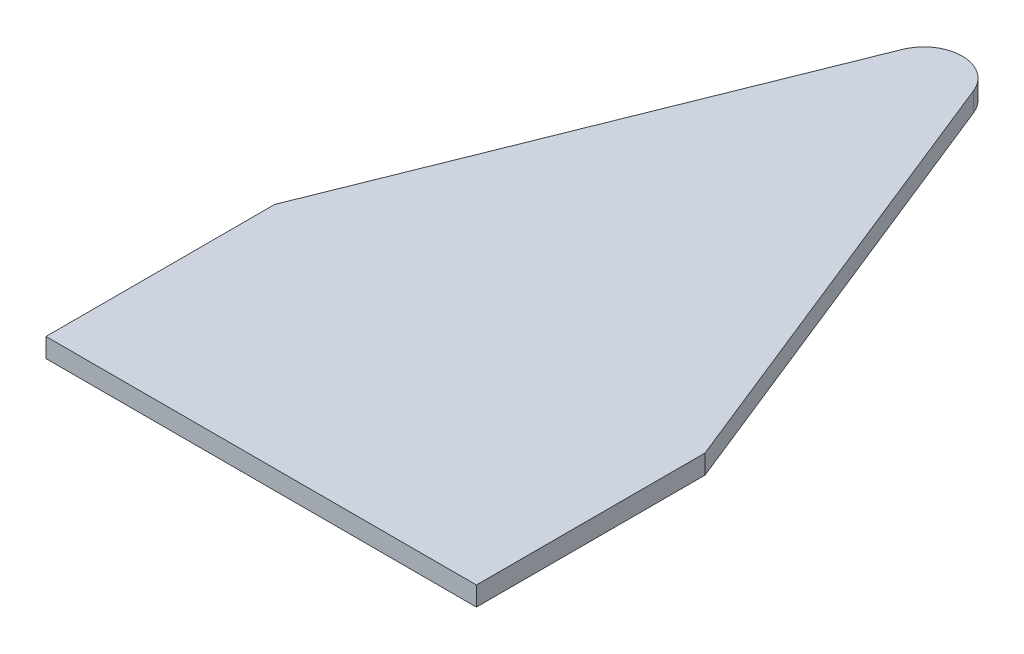
from build123d import *

# Parameters (mm, degrees)
SKETCH1_W           = 142.494
SKETCH1_H           = 75.692
BOSS_EXTRUDE2_DEPTH = 6.35
FILLET4_R           = 12.7


with BuildPart() as part:
    # Sketch1 → Boss-Extrude2 (new body)
    with BuildSketch(Plane(origin=(0, 0, 0), x_dir=(1, 0, 0), z_dir=(0, 1, 0))):
        Polygon((-71.247, 37.846), (0, 37.846), (0, 215.646), align=None)
        Polygon((0, 215.646), (0, 37.846), (71.247, 37.846), align=None)
        Rectangle(SKETCH1_W, SKETCH1_H)
    extrude(amount=BOSS_EXTRUDE2_DEPTH)

    # Fillet4
    fillet4_edges = [part.edges().sort_by_distance(p)[0] for p in [
        (0, 3.175, -215.646),
    ]]
    fillet(fillet4_edges, radius=FILLET4_R)


solid = part.part
